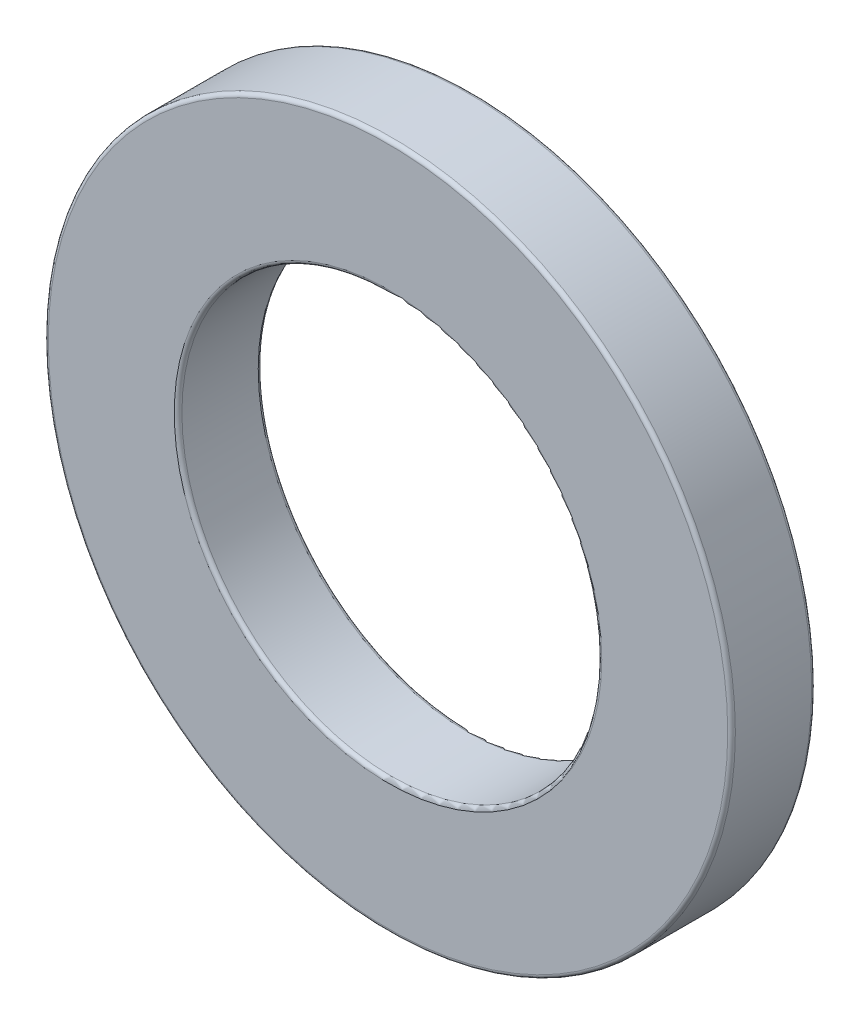
from build123d import *

# Parameters (mm, degrees)
SKETCH_1_R      = 45
SKETCH_1_R_2    = 27.5
EXTRUDE_1_DEPTH = 11
FILLET_1_R      = 0.5


with BuildPart() as part:
    # 草图1 → 拉伸1 (new body)
    with BuildSketch(Plane.XY):
        Circle(SKETCH_1_R)
        Circle(SKETCH_1_R_2, mode=Mode.SUBTRACT)
    extrude(amount=EXTRUDE_1_DEPTH)

    # 圆角1
    fillet_1_edges = [part.edges().sort_by_distance(p)[0] for p in [
        (-45, 0, 0),
        (-45, 0, 11),
        (-27.5, 0, 0),
        (-27.5, 0, 11),
    ]]
    fillet(fillet_1_edges, radius=FILLET_1_R)


solid = part.part
